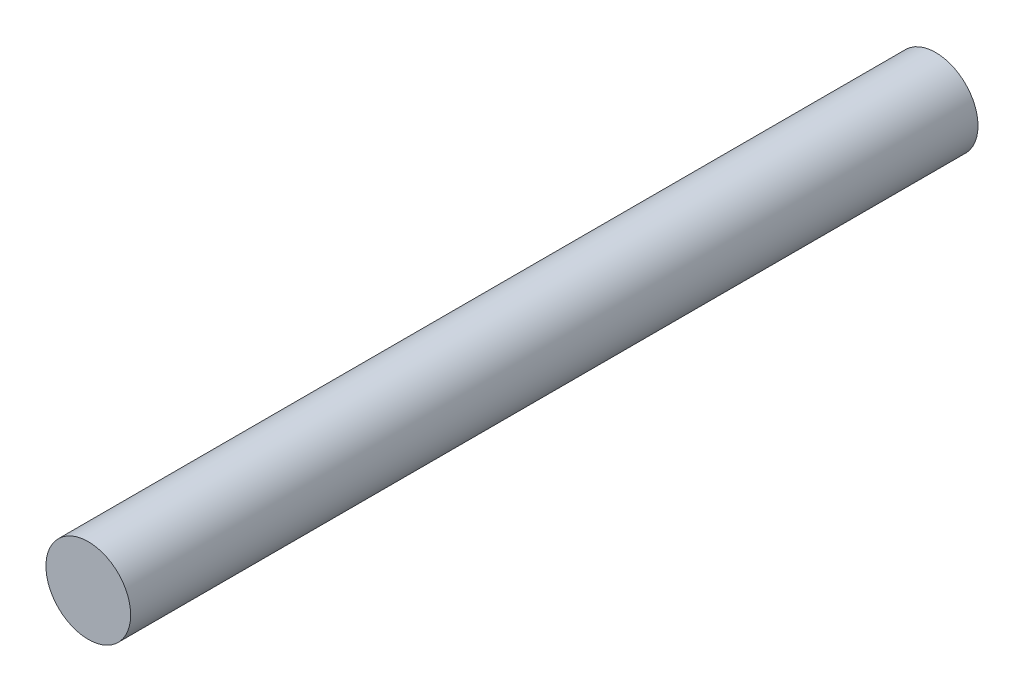
from build123d import *

# Parameters (mm, degrees)
SKETCH1_R           = 5
BOSS_EXTRUDE1_DEPTH = 50


with BuildPart() as part:
    # Sketch1 → Boss-Extrude1 (new, symmetric)
    with BuildSketch(Plane.XY):
        Circle(SKETCH1_R)
    extrude(amount=BOSS_EXTRUDE1_DEPTH, both=True)


solid = part.part
